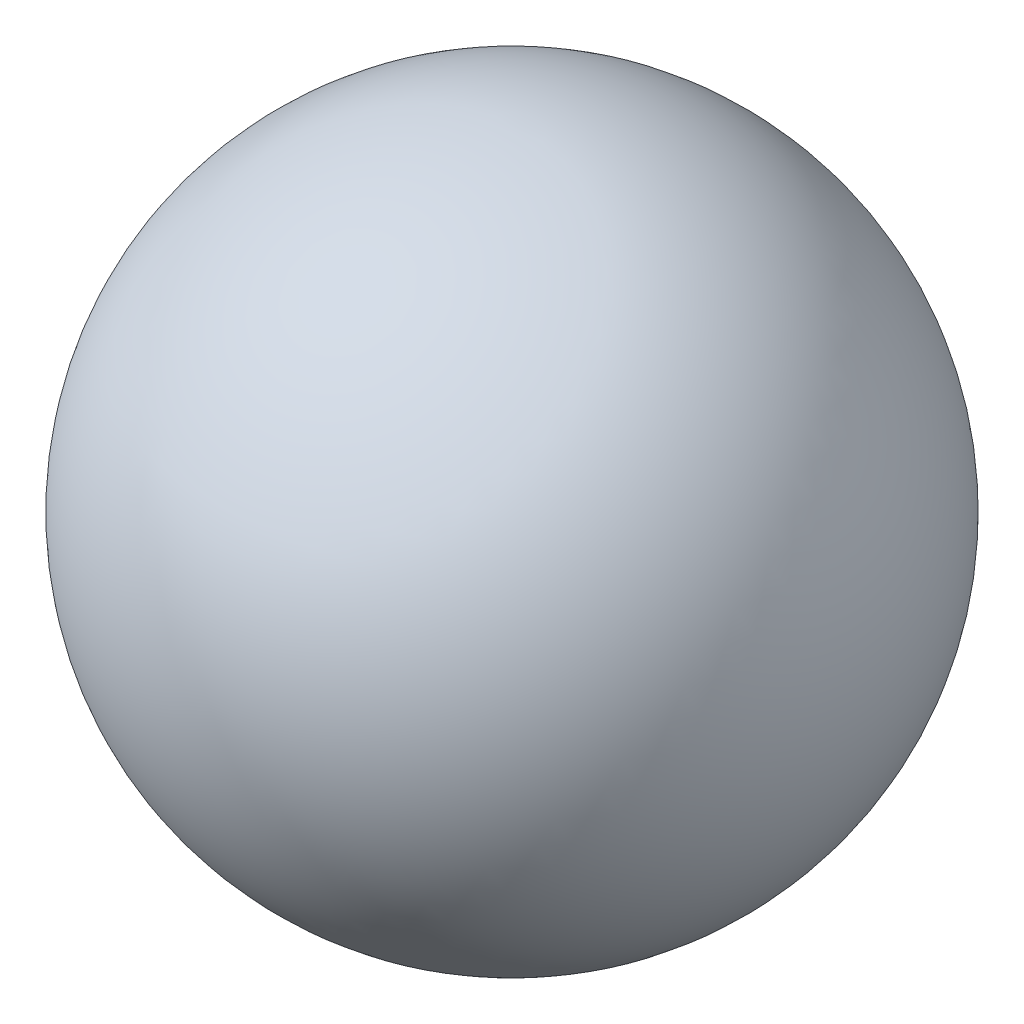
from build123d import *
from build123d.topology import SkipClean


with BuildPart() as part:
    # Sketch1 → Revolve1 (revolve)
    with SkipClean():  # the faces are left unmerged after this step: merging them gives an invalid solid
        with BuildSketch(Plane(origin=(0, 0, 0), x_dir=(0, 0, -1), z_dir=(1, 0, 0))):
            with BuildLine():
                ThreePointArc((34.29, 0), (24.246691527, 24.246691527), (0, 34.29))
                Line((0, 34.29), (0, -34.29))
                ThreePointArc((0, -34.29), (24.246691527, -24.246691527), (34.29, 0))
            make_face()
            with BuildLine():
                Line((0, -34.29), (0, 34.29))
                ThreePointArc((0, 34.29), (-34.29, 0), (0, -34.29))
            make_face()
        revolve(axis=Axis((0, 34.29, 0), (0, -1, 0)))


solid = part.part
